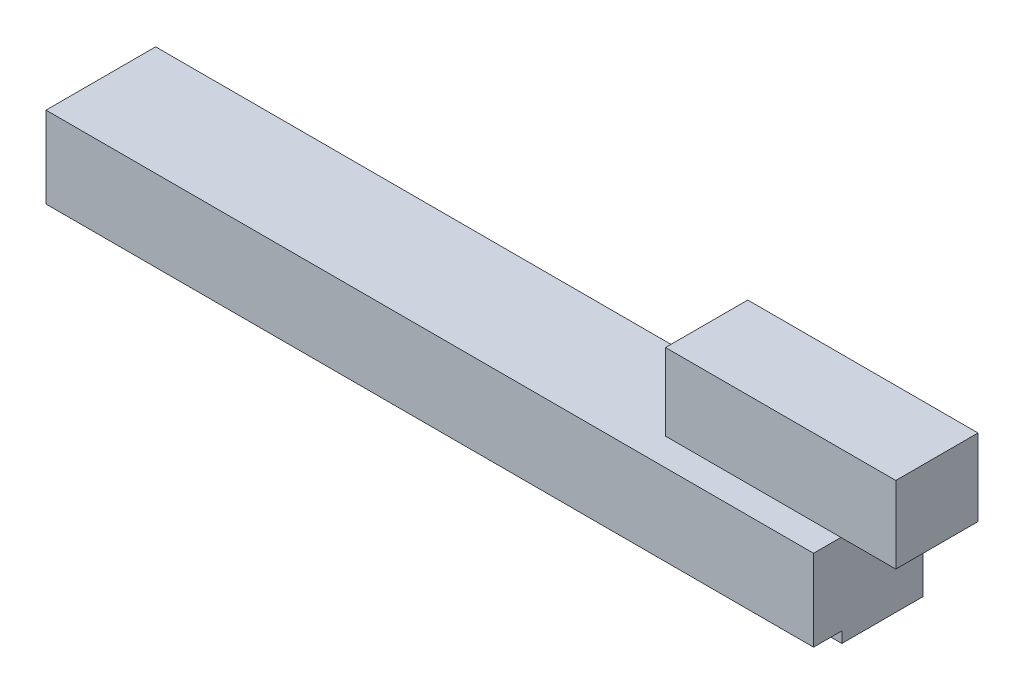
from build123d import *

# Parameters (mm, degrees)
BOSS_EXTRUDE1_DEPTH = 140
SKETCH2_W           = 42
SKETCH2_H           = 15
BOSS_EXTRUDE2_DEPTH = 14


with BuildPart() as part:
    # Sketch1 → Boss-Extrude1 (new body)
    with BuildSketch(Plane(origin=(0, 0, 0), x_dir=(0, 0, -1), z_dir=(1, 0, 0))):
        Polygon((-10, 8.42), (-10, -6.42), (-4.84, -6.42), (-4.84, -8.42), (10, -8.42), (10, 8.42), align=None)
    extrude(amount=BOSS_EXTRUDE1_DEPTH)

    # Sketch2 → Boss-Extrude2 (add)
    with BuildSketch(Plane(origin=(0, 8.42, 0), x_dir=(1, 0, 0), z_dir=(0, 1, 0))):
        with Locations((129, 2.5)):
            Rectangle(SKETCH2_W, SKETCH2_H)
    extrude(amount=BOSS_EXTRUDE2_DEPTH)


solid = part.part
